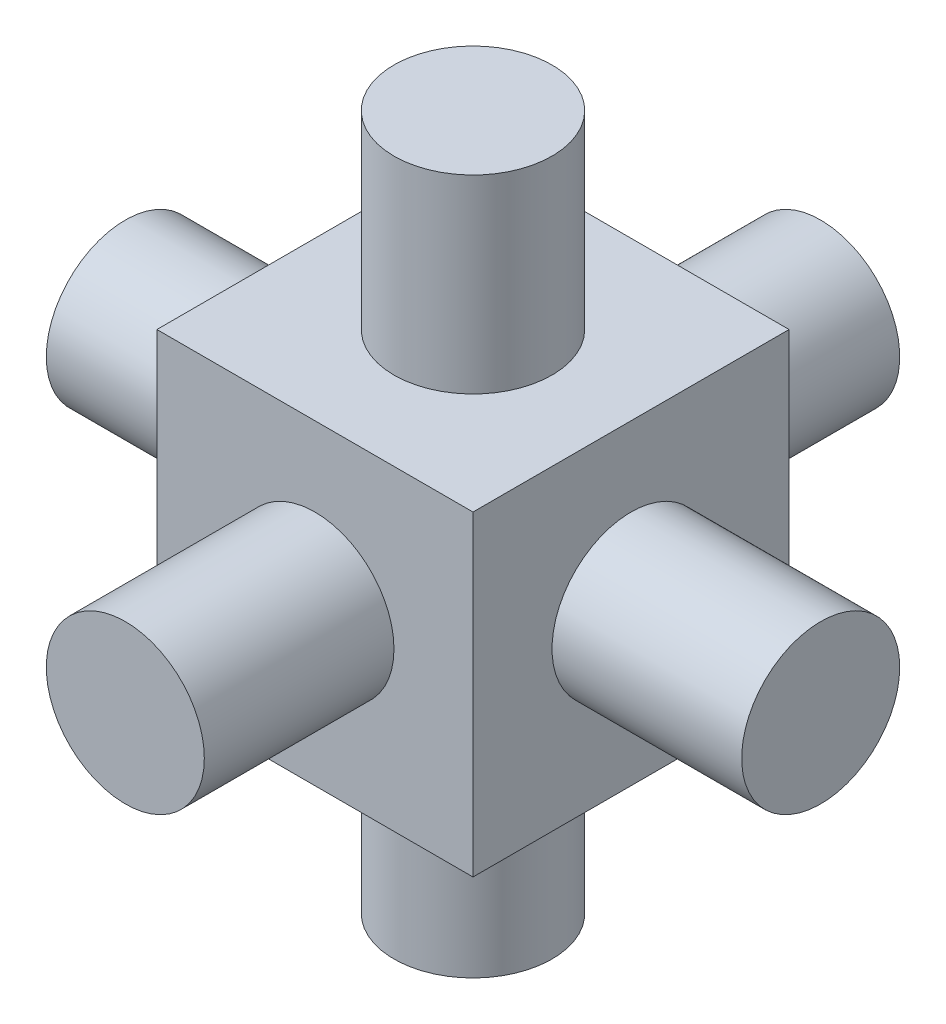
from build123d import *

# Parameters (mm, degrees)
ESBO_O1_W                = 20
ESBO_O1_H                = 20
RESSALTO_EXTRUS_O1_DEPTH = 20
ESBO_O2_R                = 5
RESSALTO_EXTRUS_O2_DEPTH = 12
ESBO_O3_R                = 5
RESSALTO_EXTRUS_O3_DEPTH = 12
RESSALTO_EXTRUS_O4_START = 12
ESBO_O4_R                = 5
RESSALTO_EXTRUS_O4_DEPTH = 12
RESSALTO_EXTRUS_O5_START = 12
ESBO_O5_R                = 5
RESSALTO_EXTRUS_O5_DEPTH = 12
ESBO_O6_R                = 5
RESSALTO_EXTRUS_O6_DEPTH = 12
RESSALTO_EXTRUS_O7_START = 12
ESBO_O7_R                = 5
RESSALTO_EXTRUS_O7_DEPTH = 12


with BuildPart() as part:
    # Esboço1 → Ressalto-extrusão1 (new body)
    with BuildSketch(Plane.XY):
        Rectangle(ESBO_O1_W, ESBO_O1_H)
    extrude(amount=RESSALTO_EXTRUS_O1_DEPTH)

    # Esboço2 → Ressalto-extrusão2 (add)
    with BuildSketch(Plane(origin=(10, 0, 0), x_dir=(0, 0, -1), z_dir=(1, 0, 0))):
        with Locations((-10, 0)):
            Circle(ESBO_O2_R)
    extrude(amount=RESSALTO_EXTRUS_O2_DEPTH)

    # Esboço3 → Ressalto-extrusão3 (add)
    with BuildSketch(Plane(origin=(0, 10, 0), x_dir=(1, 0, 0), z_dir=(0, 1, 0))):
        with Locations(Location((0, -10, 0), (0, 0, 270))):
            Circle(ESBO_O3_R)
    extrude(amount=RESSALTO_EXTRUS_O3_DEPTH)

    # Esboço4 → Ressalto-extrusão4 (add)
    with BuildSketch(Plane.ZY.offset(10).offset(RESSALTO_EXTRUS_O4_START)):
        with Locations(Location((10, 0, 0), (0, 0, 180))):
            Circle(ESBO_O4_R)
    extrude(amount=-RESSALTO_EXTRUS_O4_DEPTH)

    # Esboço5 → Ressalto-extrusão5 (add)
    with BuildSketch(Plane.XZ.offset(10).offset(RESSALTO_EXTRUS_O5_START)):
        with Locations(Location((0, 10, 0), (0, 0, 90))):
            Circle(ESBO_O5_R)
    extrude(amount=-RESSALTO_EXTRUS_O5_DEPTH)

    # Esboço6 → Ressalto-extrusão6 (add)
    with BuildSketch(Plane(origin=(0, 0, 0), x_dir=(-1, 0, 0), z_dir=(0, 0, -1))):
        Circle(ESBO_O6_R)
    extrude(amount=RESSALTO_EXTRUS_O6_DEPTH)

    # Esboço7 → Ressalto-extrusão7 (add)
    with BuildSketch(Plane.XY.offset(20).offset(RESSALTO_EXTRUS_O7_START)):
        with Locations(Location((0, 0, 0), (0, 0, 180))):
            Circle(ESBO_O7_R)
    extrude(amount=-RESSALTO_EXTRUS_O7_DEPTH)


solid = part.part
